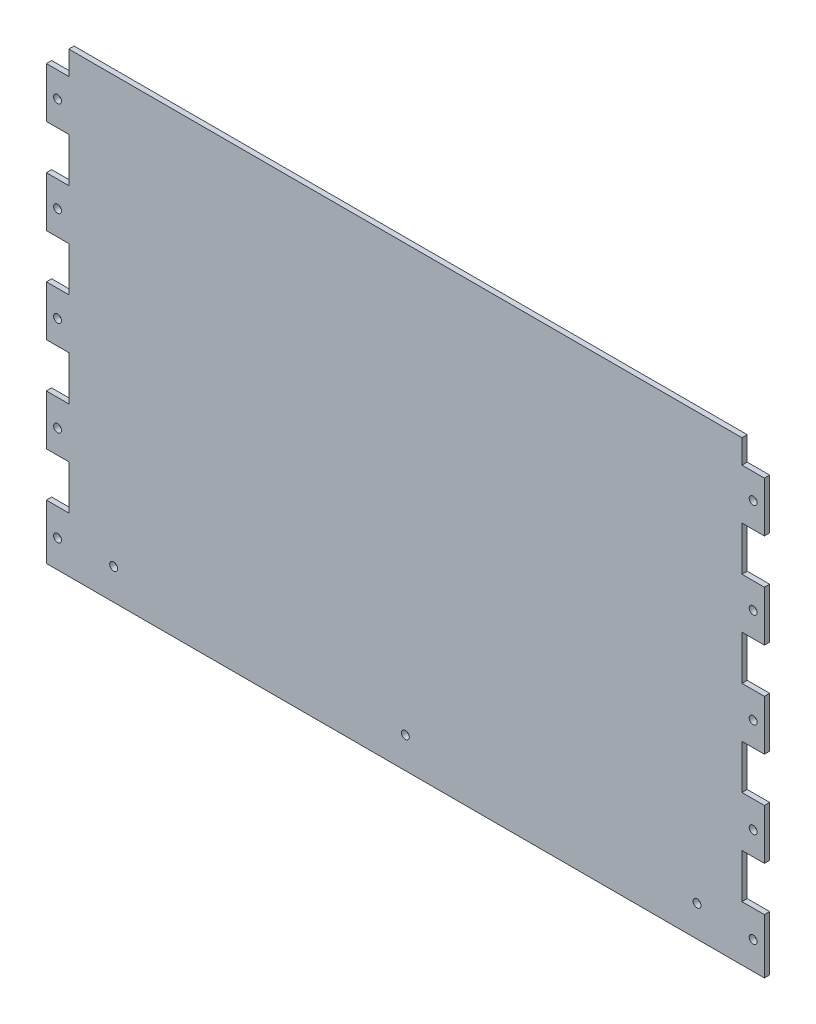
from build123d import *

# Parameters (mm, degrees)
SKETCH1_R           = 1.5
BOSS_EXTRUDE1_DEPTH = 2


with BuildPart() as part:
    # Sketch1 → Boss-Extrude1 (new body)
    with BuildSketch(Plane.XY):
        Polygon((0, 20.8), (8.5, 20.8), (8.5, 37.6), (0, 37.6), (0, 56.6), (8.5, 56.6), (8.5, 73.4), (0, 73.4), (0, 92.4), (8.5, 92.4), (8.5, 109.2), (0, 109.2), (0, 128.2), (8.5, 128.2), (8.5, 145), (0, 145), (0, 164), (8.5, 164), (8.5, 173), (263.5, 173), (263.5, 164), (272, 164), (272, 145), (263.5, 145), (263.5, 128.2), (272, 128.2), (272, 109.2), (263.5, 109.2), (263.5, 92.4), (272, 92.4), (272, 73.4), (263.5, 73.4), (263.5, 56.6), (272, 56.6), (272, 37.6), (263.5, 37.6), (263.5, 20.8), (272, 20.8), (272, 0), (0, 0), align=None)
        with Locations((4.25, 154.5)):
            Circle(SKETCH1_R, mode=Mode.SUBTRACT)
        with Locations((4.25, 118.5)):
            Circle(SKETCH1_R, mode=Mode.SUBTRACT)
        with Locations((4.25, 82.5)):
            Circle(SKETCH1_R, mode=Mode.SUBTRACT)
        with Locations((4.25, 46.5)):
            Circle(SKETCH1_R, mode=Mode.SUBTRACT)
        with Locations((4.25, 10.5)):
            Circle(SKETCH1_R, mode=Mode.SUBTRACT)
        with Locations(Location((267.75, 10.5, 0), (0, 0, 180))):
            Circle(SKETCH1_R, mode=Mode.SUBTRACT)
        with Locations(Location((267.75, 46.5, 0), (0, 0, 180))):
            Circle(SKETCH1_R, mode=Mode.SUBTRACT)
        with Locations(Location((267.75, 82.5, 0), (0, 0, 180))):
            Circle(SKETCH1_R, mode=Mode.SUBTRACT)
        with Locations(Location((267.75, 118.5, 0), (0, 0, 180))):
            Circle(SKETCH1_R, mode=Mode.SUBTRACT)
        with Locations(Location((267.75, 154.5, 0), (0, 0, 180))):
            Circle(SKETCH1_R, mode=Mode.SUBTRACT)
        with Locations((25.5, 11.75)):
            Circle(SKETCH1_R, mode=Mode.SUBTRACT)
        with Locations((136, 11.75)):
            Circle(SKETCH1_R, mode=Mode.SUBTRACT)
        with Locations((246.5, 11.75)):
            Circle(SKETCH1_R, mode=Mode.SUBTRACT)
    extrude(amount=BOSS_EXTRUDE1_DEPTH)


solid = part.part
